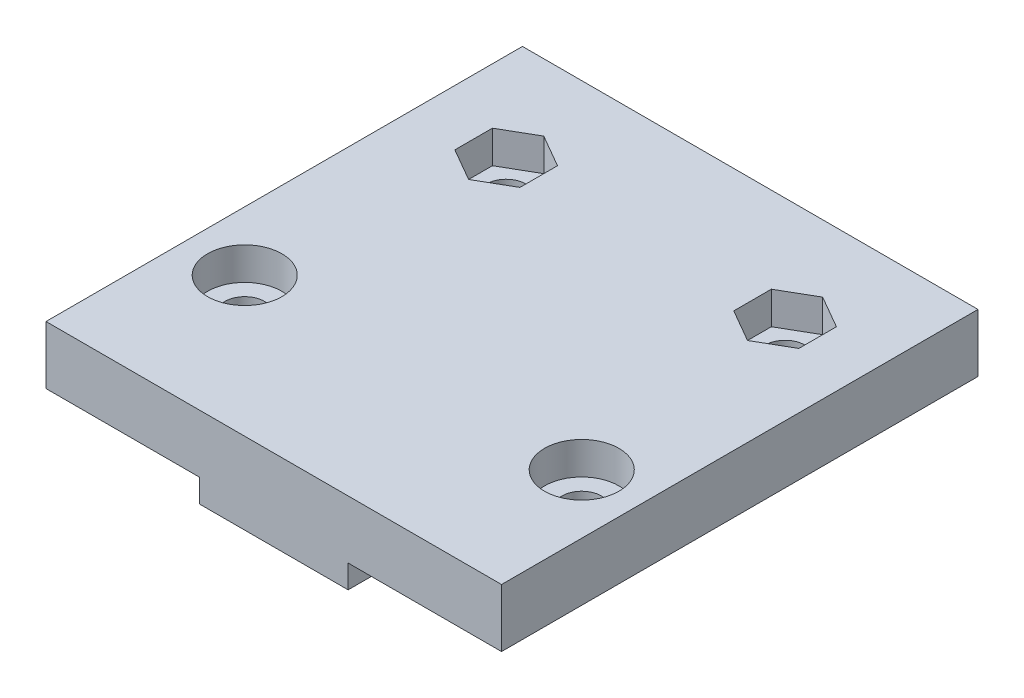
from build123d import *

# Parameters (mm, degrees)
SKETCH_1_W          = 40
SKETCH_1_H          = 20
EXTRUDE_1_DEPTH     = 6
SKETCH_2_W          = 40
SKETCH_2_H          = 32.5
EXTRUDE_2_DEPTH     = 35
CUT_EXTRUDE_1_DEPTH = 13
CUT_EXTRUDE_2_DEPTH = 2
SKETCH_6_W          = 40
SKETCH_6_H          = 41
CUT_EXTRUDE_3_DEPTH = 5
SKETCH_8_R          = 1.7
CUT_EXTRUDE_4_DEPTH = 49.79805324
SKETCH_9_W          = 40
SKETCH_9_H          = 12.5
SKETCH_9_H_2        = 8
CUT_EXTRUDE_5_DEPTH = 41
CUT_EXTRUDE_6_DEPTH = 2
SKETCH_11_R         = 3.2
CUT_EXTRUDE_7_DEPTH = 2.8
SKETCH_12_W         = 0.4
SKETCH_12_H         = 41
CUT_EXTRUDE_8_DEPTH = 5
SKETCH_13_W         = 8
SKETCH_13_H         = 1
CUT_EXTRUDE_9_DEPTH = 2


with BuildPart() as part:
    # Эскиз1 → Бобышка-Вытянуть1 (new body)
    with BuildSketch(Plane.XY):
        Rectangle(SKETCH_1_W, SKETCH_1_H)
    extrude(amount=EXTRUDE_1_DEPTH)

    # Эскиз2 → Бобышка-Вытянуть2 (add)
    with BuildSketch(Plane(origin=(0, 0, 0), x_dir=(-1, 0, 0), z_dir=(0, 0, -1))):
        with Locations((0, 6.25)):
            Rectangle(SKETCH_2_W, SKETCH_2_H)
    extrude(amount=EXTRUDE_2_DEPTH)

    # Эскиз3 → Вырез-Вытянуть1 (cut)
    with BuildSketch(Plane.XZ.offset(10)):
        Polygon((-7, 6), (-7, -1), (-9, -1), (-9, -23), (-6.5, -26), (-6.5, -33), (-4.5, -33), (-4.5, -35), (4.5, -35), (4.5, -33), (6.5, -33), (6.5, -26), (9, -23), (9, -1), (7, -1), (7, 6), align=None)
    extrude(amount=-CUT_EXTRUDE_1_DEPTH, mode=Mode.SUBTRACT)

    # Эскиз5 → Вырез-Вытянуть2 (cut)
    with BuildSketch(Plane.XZ.offset(-3)):
        Polygon((-9, -1), (9, -1), (9, -23), (6.5, -26), (6.5, -33), (-6.5, -33), (-6.5, -26), (-9, -23), align=None)
    extrude(amount=-CUT_EXTRUDE_2_DEPTH, mode=Mode.SUBTRACT)

    # Эскиз6 → Вырез-Вытянуть3 (cut)
    with BuildSketch(Plane.XZ.offset(10)):
        with Locations((0, -14.5)):
            Rectangle(SKETCH_6_W, SKETCH_6_H)
    extrude(amount=-CUT_EXTRUDE_3_DEPTH, mode=Mode.SUBTRACT)

    # Эскиз8 → Вырез-Вытянуть4 (cut, through all)
    with BuildSketch(Plane.XZ.offset(5)):
        with Locations((12, -26)):
            Circle(SKETCH_8_R)
        with Locations((14.5, -6)):
            Circle(SKETCH_8_R)
        with Locations(Location((-12, -26, 0), (0, 0, 180))):
            Circle(SKETCH_8_R)
        with Locations(Location((-14.5, -6, 0), (0, 0, 180))):
            Circle(SKETCH_8_R)
    extrude(amount=-CUT_EXTRUDE_4_DEPTH, mode=Mode.SUBTRACT)

    # Эскиз9 → Вырез-Вытянуть5 (cut)
    with BuildSketch(Plane.XY.offset(6)):
        with Locations((0, 16.25)):
            Rectangle(SKETCH_9_W, SKETCH_9_H)
        with Locations((0, -1)):
            Rectangle(SKETCH_9_W, SKETCH_9_H_2)
    extrude(amount=-CUT_EXTRUDE_5_DEPTH, mode=Mode.SUBTRACT)

    # Эскиз10 → Вырез-Вытянуть6 (cut)
    with BuildSketch(Plane.XZ.offset(-3)):
        Polygon((-20, 6), (-6.4, 6), (-6.4, -1), (-4, -33), (-4, -35), (-20, -35), align=None)
    cut_extrude_6 = extrude(amount=-CUT_EXTRUDE_6_DEPTH, mode=Mode.SUBTRACT)

    # Зеркальное отражение1: Вырез-Вытянуть6 across plane
    add(cut_extrude_6.mirror(Plane(origin=(0, 0, 0), x_dir=(0, 0, 1), z_dir=(1, 0, 0))), mode=Mode.SUBTRACT)

    # Эскиз11 → Вырез-Вытянуть7 (cut)
    with BuildSketch(Plane(origin=(0, 10, 0), x_dir=(1, 0, 0), z_dir=(0, 1, 0))):
        with Locations(Location((14.5, 6, 0), (0, 0, 180))):
            Circle(SKETCH_11_R)
        with Locations((-14.5, 6)):
            Circle(SKETCH_11_R)
        Polygon((-12, 29.233161507), (-14.8, 27.616580754), (-14.8, 24.383419246), (-12, 22.766838493), (-9.2, 24.383419246), (-9.2, 27.616580754), align=None)
        Polygon((9.2, 27.616580754), (12, 29.233161507), (14.8, 27.616580754), (14.8, 24.383419246), (12, 22.766838493), (9.2, 24.383419246), align=None)
    extrude(amount=-CUT_EXTRUDE_7_DEPTH, mode=Mode.SUBTRACT)

    # Эскиз12 → Вырез-Вытянуть8 (cut)
    with BuildSketch(Plane(origin=(0, 10, 0), x_dir=(1, 0, 0), z_dir=(0, 1, 0))):
        with Locations((-19.8, 14.5)):
            Rectangle(SKETCH_12_W, SKETCH_12_H)
        with Locations((19.8, 14.5)):
            Rectangle(SKETCH_12_W, SKETCH_12_H)
    extrude(amount=-CUT_EXTRUDE_8_DEPTH, mode=Mode.SUBTRACT)

    # Эскиз13 → Вырез-Вытянуть9 (cut)
    with BuildSketch(Plane(origin=(0, 0, -35), x_dir=(-1, 0, 0), z_dir=(0, 0, -1))):
        with Locations((0, 3.5)):
            Rectangle(SKETCH_13_W, SKETCH_13_H)
    extrude(amount=-CUT_EXTRUDE_9_DEPTH, mode=Mode.SUBTRACT)


solid = part.part
